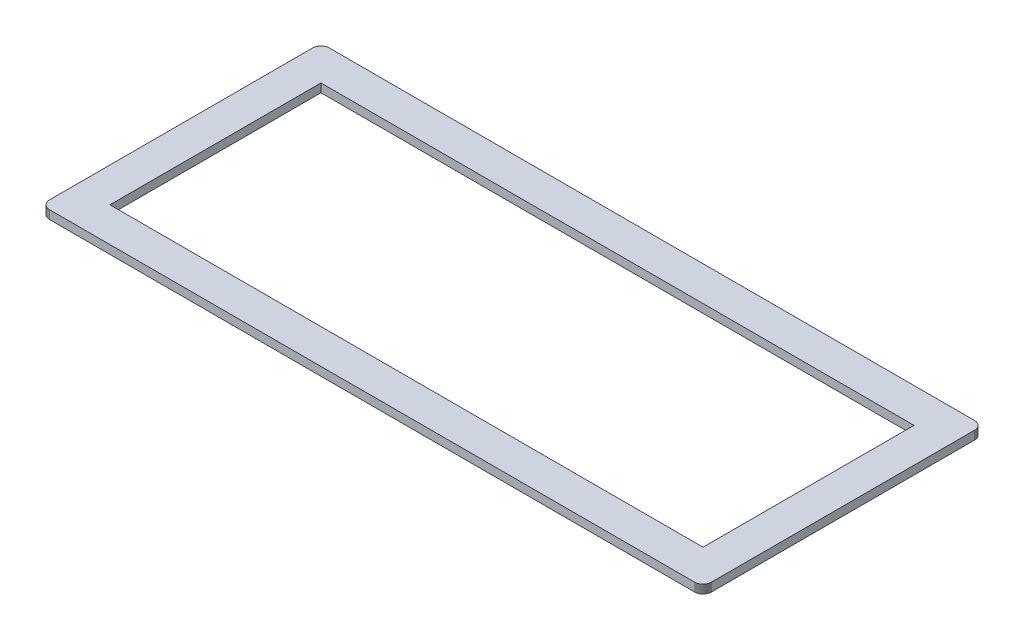
from build123d import *

# Parameters (mm, degrees)
SKETCH1_W           = 347.4626
SKETCH1_H           = 123.6255
BOSS_EXTRUDE1_DEPTH = 5


with BuildPart() as part:
    # Sketch1 → Boss-Extrude1 (new body)
    with BuildSketch(Plane(origin=(0, 0, 0), x_dir=(1, 0, 0), z_dir=(0, 1, 0))):
        Polygon((382.958, 164.299), (383.35, 164.284), (383.741, 164.237), (384.126, 164.162), (384.503, 164.055), (384.87, 163.919), (385.226, 163.755), (385.572, 163.564), (385.897, 163.344), (386.203, 163.102), (386.493, 162.834), (386.761, 162.547), (387.004, 162.238), (387.223, 161.913), (387.414, 161.569), (387.576, 161.212), (387.713, 160.845), (387.819, 160.467), (387.897, 160.082), (387.943, 159.693), (387.96, 159.299), (387.96, 5.27237), (387.943, 4.881), (387.897, 4.49104), (387.819, 4.10655), (387.713, 3.72759), (387.576, 3.35966), (387.414, 3.00412), (387.223, 2.66099), (387.004, 2.3344), (386.761, 2.02572), (386.493, 1.73771), (386.203, 1.47037), (385.897, 1.22783), (385.572, 1.0101), (385.226, 0.818554), (384.87, 0.654569), (384.503, 0.518142), (384.126, 0.412034), (383.741, 0.334863), (383.35, 0.289388), (382.958, 0.272852), (5.09598, 0.272852), (4.70186, 0.289388), (4.3119, 0.334863), (3.9274, 0.412034), (3.54983, 0.518142), (3.18189, 0.654569), (2.82498, 0.818554), (2.48185, 1.0101), (2.15663, 1.22783), (1.84795, 1.47037), (1.55994, 1.73771), (1.2926, 2.02572), (1.05006, 2.3344), (0.830957, 2.66099), (0.63941, 3.00412), (0.475424, 3.35966), (0.338998, 3.72759), (0.232888, 4.10655), (0.157097, 4.49104), (0.110243, 4.881), (0.0950846, 5.27375), (0.0950846, 159.299), (0.110243, 159.693), (0.157097, 160.082), (0.232888, 160.467), (0.338998, 160.845), (0.475424, 161.212), (0.63941, 161.569), (0.830957, 161.913), (1.05006, 162.238), (1.2926, 162.547), (1.55994, 162.834), (1.84795, 163.102), (2.15663, 163.344), (2.48185, 163.564), (2.82498, 163.755), (3.18189, 163.919), (3.54983, 164.055), (3.9274, 164.162), (4.3119, 164.237), (4.70186, 164.284), (5.09598, 164.299), align=None)
        with Locations((194.0257, 82.28625)):
            Rectangle(SKETCH1_W, SKETCH1_H, mode=Mode.SUBTRACT)
    extrude(amount=BOSS_EXTRUDE1_DEPTH)


solid = part.part
